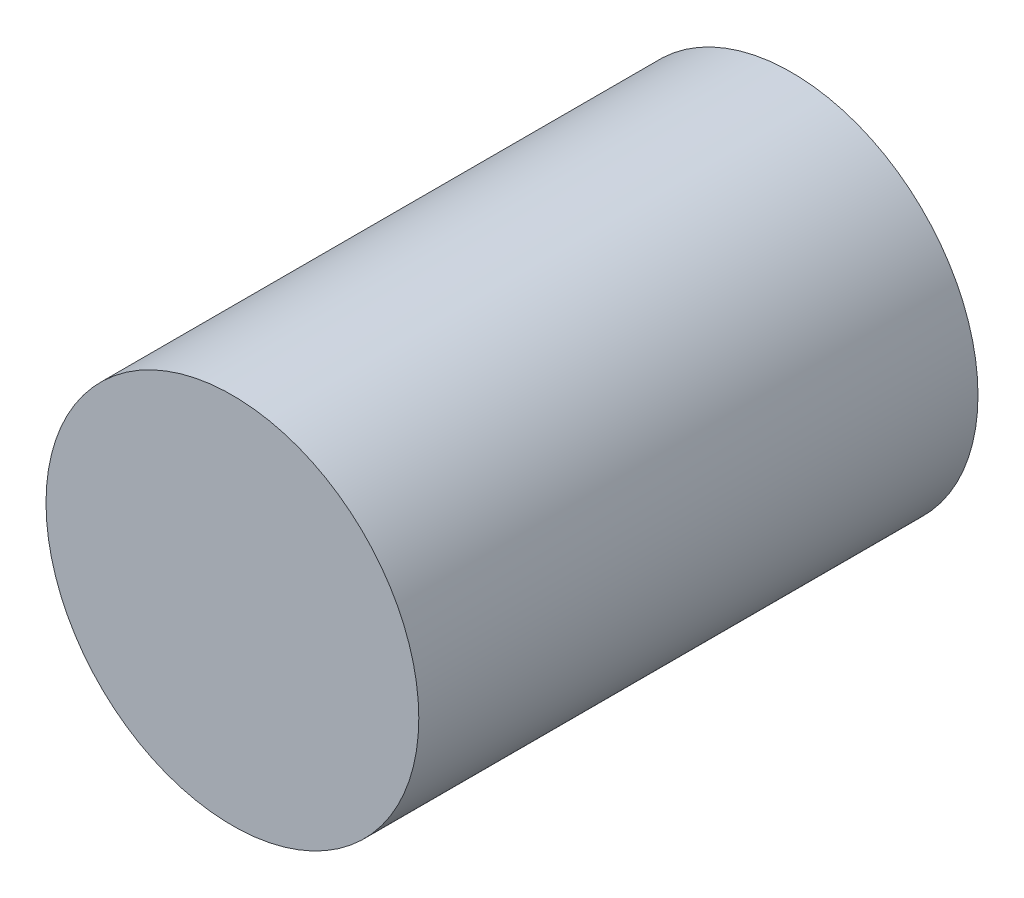
from build123d import *

# Parameters (mm, degrees)
SKETCH_1_R      = 9
EXTRUDE_2_DEPTH = 27


with BuildPart() as part:
    # 草图1 → 凸台-拉伸2 (new body)
    with BuildSketch(Plane.XY):
        Circle(SKETCH_1_R)
    extrude(amount=EXTRUDE_2_DEPTH)


solid = part.part
